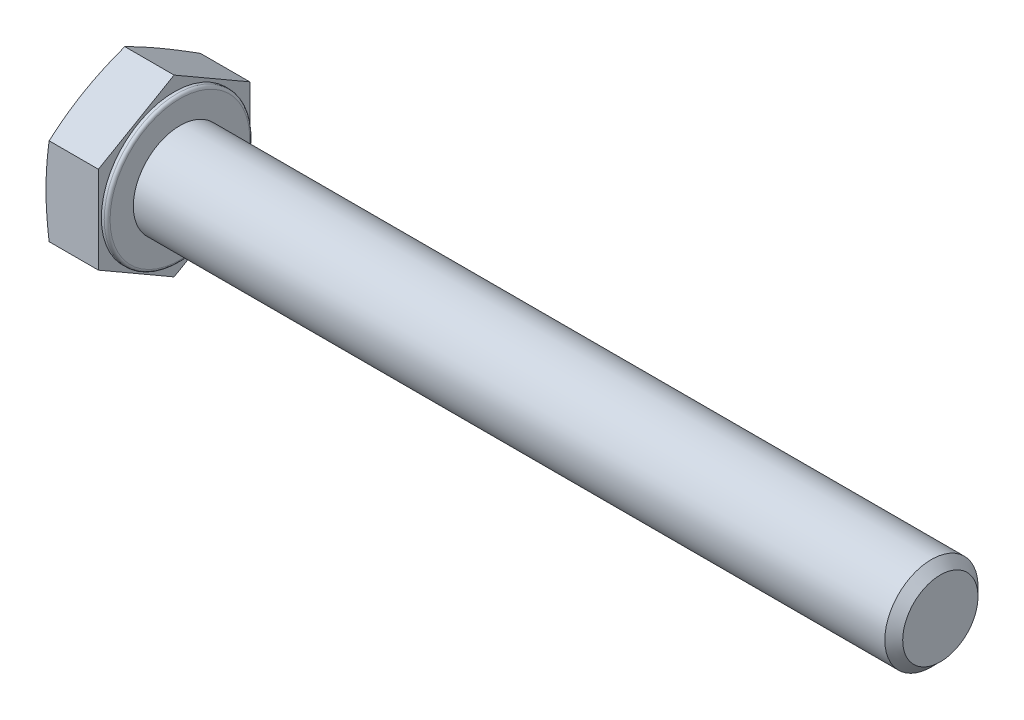
from build123d import *

# Parameters (mm, degrees)
SKETCH_2_W          = 52
SKETCH_2_H          = 52
CUT_EXTRUDE_1_DEPTH = 4.5


with BuildPart() as part:
    # 草图1 → 旋转1 (revolve)
    with BuildSketch(Plane.XY):
        with BuildLine():
            Line((0, 0), (0, 6.5))
            Line((0, 6.5), (0.34833395, 7.8))
            Line((0.34833395, 7.8), (4.5, 7.8))
            Line((4.5, 7.8), (4.5, 6.25))
            Line((4.5, 6.25), (4.75, 6.25))
            ThreePointArc((4.75, 6.25), (4.926776695, 6.176776695), (5, 6))
            Line((5, 6), (5, 4))
            Line((5, 4), (69.533, 4))
            Line((69.533, 4), (70.3, 3.233))
            Line((70.3, 3.233), (70.3, 0))
            Line((70.3, 0), (0, 0))
        make_face()
    revolve(axis=Axis((70.3, 0, 0), (-1, 0, 0)))

    # 草图2 → 切除-拉伸1 (cut)
    with BuildSketch(Plane(origin=(0, 0, 0), x_dir=(0, 0, -1), z_dir=(1, 0, 0))):
        Rectangle(SKETCH_2_W, SKETCH_2_H)
        Polygon((-6.5, 3.75277675), (-6.5, -3.75277675), (0, -7.505553499), (6.5, -3.75277675), (6.5, 3.75277675), (0, 7.505553499), align=None, mode=Mode.SUBTRACT)
    extrude(amount=CUT_EXTRUDE_1_DEPTH, mode=Mode.SUBTRACT)


solid = part.part
